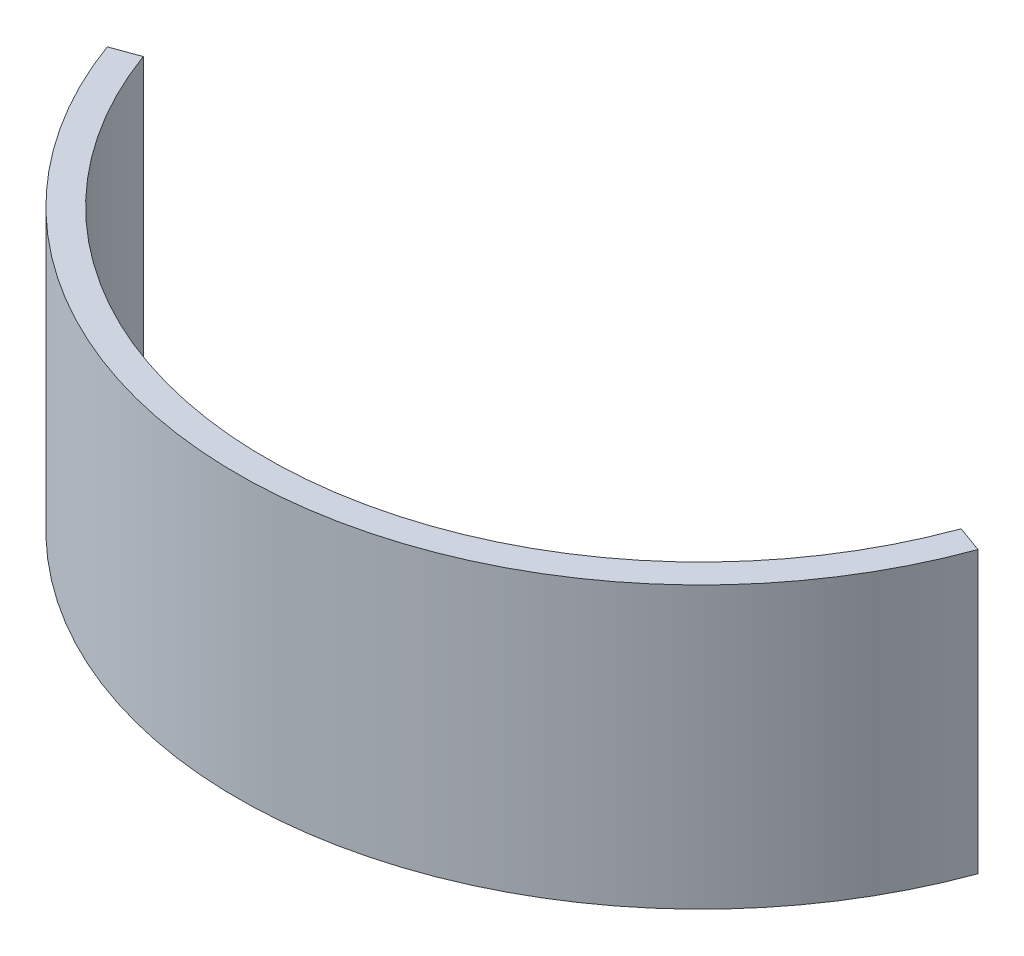
from build123d import *

# Parameters (mm, degrees)
EXTRUDE_THIN1_DEPTH = 20


with BuildPart() as part:
    # Sketch1 → Extrude-Thin1 (new body)
    with BuildSketch(Plane(origin=(0, 0, 0), x_dir=(1, 0, 0), z_dir=(0, 1, 0))):
        with BuildLine():
            ThreePointArc((-31.009856486, -11.28666473), (0, -33), (31.009856486, -11.28666473))
            Line((31.009856486, -11.28666473), (29.130471244, -10.602624443))
            ThreePointArc((29.130471244, -10.602624443), (0, -31), (-29.130471244, -10.602624443))
            Line((-29.130471244, -10.602624443), (-31.009856486, -11.28666473))
        make_face()
    extrude(amount=EXTRUDE_THIN1_DEPTH)


solid = part.part
